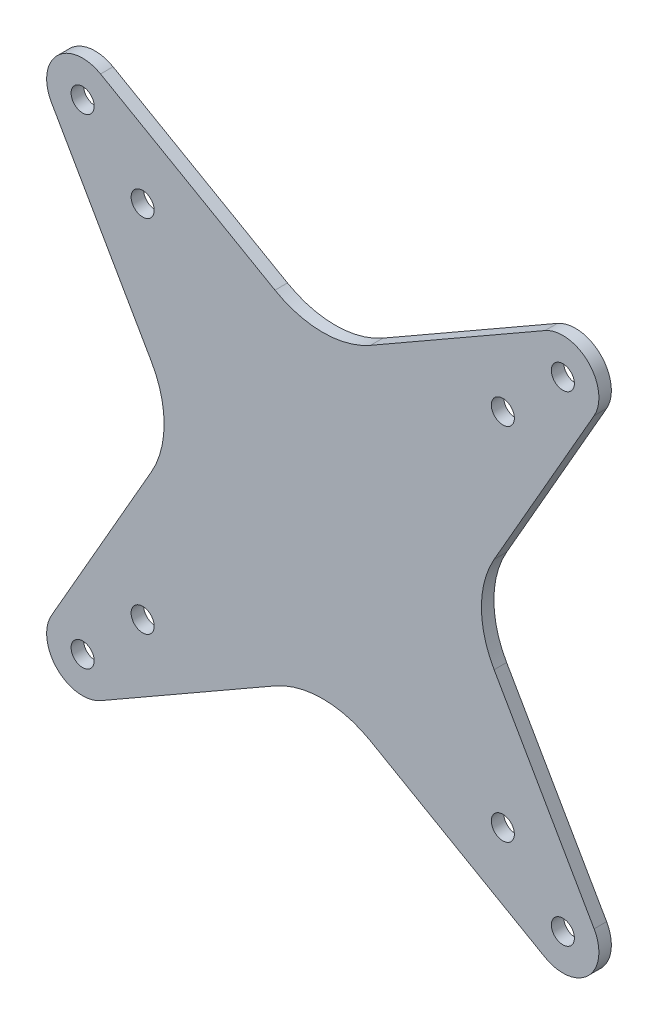
from build123d import *

# Parameters (mm, degrees)
BOSS_EXTRUDE1_DEPTH  = 2.6
M4_CLEARANCE_HOLE1_D = 4.8


with BuildPart() as part:
    # Sketch1 → Boss-Extrude1 (new body)
    with BuildSketch(Plane.XY):
        with BuildLine():
            Line((-35.68229717, 9.947502865), (-56.506516782, 46.269686426))
            ThreePointArc((-56.506516782, 46.269686426), (-55.303300859, 55.303300859), (-46.269686426, 56.506516782))
            Line((-46.269686426, 56.506516782), (-9.947502865, 35.68229717))
            ThreePointArc((-9.947502865, 35.68229717), (0, 33.033008589), (9.947502865, 35.68229717))
            Line((9.947502865, 35.68229717), (46.269686426, 56.506516782))
            ThreePointArc((46.269686426, 56.506516782), (55.303300859, 55.303300859), (56.506516782, 46.269686426))
            Line((56.506516782, 46.269686426), (35.68229717, 9.947502865))
            ThreePointArc((35.68229717, 9.947502865), (33.033008589, 0), (35.68229717, -9.947502865))
            Line((35.68229717, -9.947502865), (56.506516782, -46.269686426))
            ThreePointArc((56.506516782, -46.269686426), (55.303300859, -55.303300859), (46.269686426, -56.506516782))
            Line((46.269686426, -56.506516782), (9.947502865, -35.68229717))
            ThreePointArc((9.947502865, -35.68229717), (0, -33.033008589), (-9.947502865, -35.68229717))
            Line((-9.947502865, -35.68229717), (-46.269686426, -56.506516782))
            ThreePointArc((-46.269686426, -56.506516782), (-55.303300859, -55.303300859), (-56.506516782, -46.269686426))
            Line((-56.506516782, -46.269686426), (-35.68229717, -9.947502865))
            ThreePointArc((-35.68229717, -9.947502865), (-33.033008589, 0), (-35.68229717, 9.947502865))
        make_face()
    extrude(amount=BOSS_EXTRUDE1_DEPTH)

    # M4 Clearance Hole1 (through all)
    with Locations(Plane(origin=(0, 0, 0), x_dir=(1, 0, 0), z_dir=(0, 0, -1))):
        with Locations((-50, -50), (-37.5, -37.5), (37.5, -37.5), (50, -50), (50, 50), (37.5, 37.5), (-37.5, 37.5), (-50, 50)):
            Hole(M4_CLEARANCE_HOLE1_D / 2)


solid = part.part
